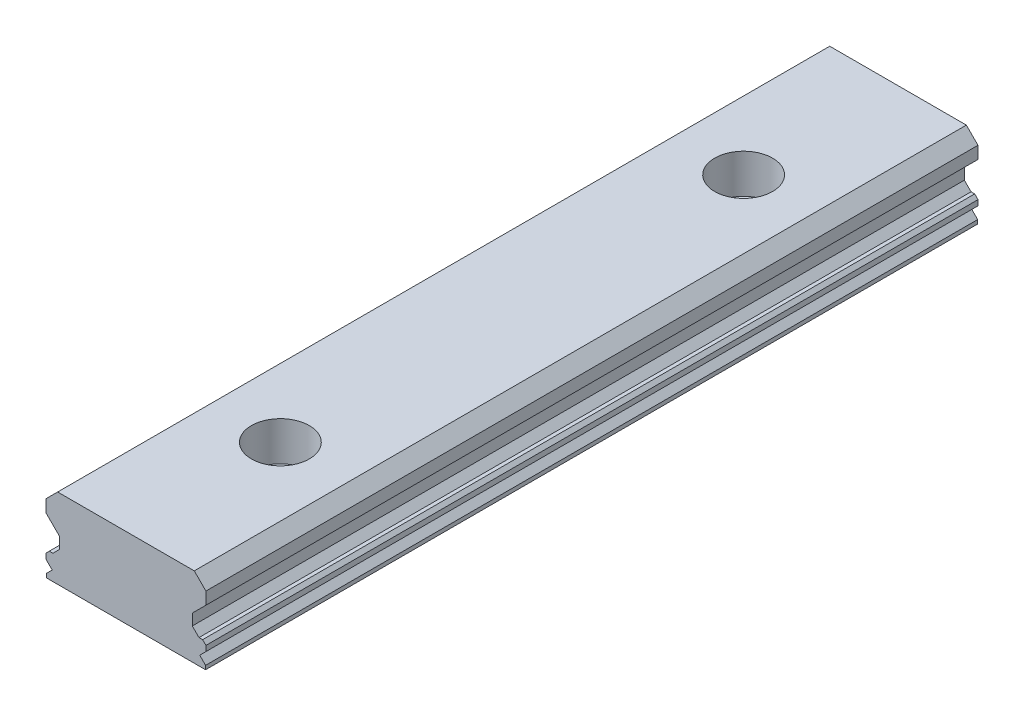
from build123d import *

# Parameters (mm, degrees)
BOSS_EXTRUDE1_DEPTH = 100
SKETCH2_R           = 3.75
CUT_EXTRUDE1_DEPTH  = 5.064116728
SKETCH3_R           = 2.25
CUT_EXTRUDE2_DEPTH  = 101.674424562


with BuildPart() as part:
    # Sketch1 → Boss-Extrude1 (new body)
    with BuildSketch(Plane.XY):
        Polygon((-10.313155992, -4.579057074), (-10.313155992, -5.079057074), (10.313155992, -5.079057074), (10.313155992, -4.579057074), (9.554252946, -3.820154028), (10.356146045, -3.018260929), (10.356146045, -2.320637728), (9.927498969, -1.891990652), (9.459466628, -1.891990652), (8.591867013, -1.024391036), (8.591867013, 0.420032401), (10.356146045, 2.184311433), (10.356146045, 3.776726056), (8.847812446, 5.285059654), (-8.847812446, 5.285059654), (-10.356146045, 3.776726056), (-10.356146045, 2.184311433), (-8.591867013, 0.420032401), (-8.591867013, -1.024391036), (-9.459466628, -1.891990652), (-9.927498969, -1.891990652), (-10.356146045, -2.320637728), (-10.356146045, -3.018260929), (-9.554252946, -3.820154028), align=None)
    extrude(amount=BOSS_EXTRUDE1_DEPTH)

    # Sketch2 → Cut-Extrude1 (cut)
    with BuildSketch(Plane(origin=(0, 5.285059654, 0), x_dir=(1, 0, 0), z_dir=(0, 1, 0))):
        with Locations(Location((0, -20, 0), (0, 0, 270))):
            Circle(SKETCH2_R)
        with Locations(Location((0, -80, 0), (0, 0, 270))):
            Circle(SKETCH2_R)
    extrude(amount=-CUT_EXTRUDE1_DEPTH, mode=Mode.SUBTRACT)

    # Sketch3 → Cut-Extrude2 (cut, through all)
    with BuildSketch(Plane(origin=(0, 0.220942926, 0), x_dir=(1, 0, 0), z_dir=(0, 1, 0))):
        with Locations(Location((0, -20, 0), (0, 0, 270))):
            Circle(SKETCH3_R)
        with Locations(Location((0, -80, 0), (0, 0, 270))):
            Circle(SKETCH3_R)
    extrude(amount=-CUT_EXTRUDE2_DEPTH, mode=Mode.SUBTRACT)


solid = part.part
